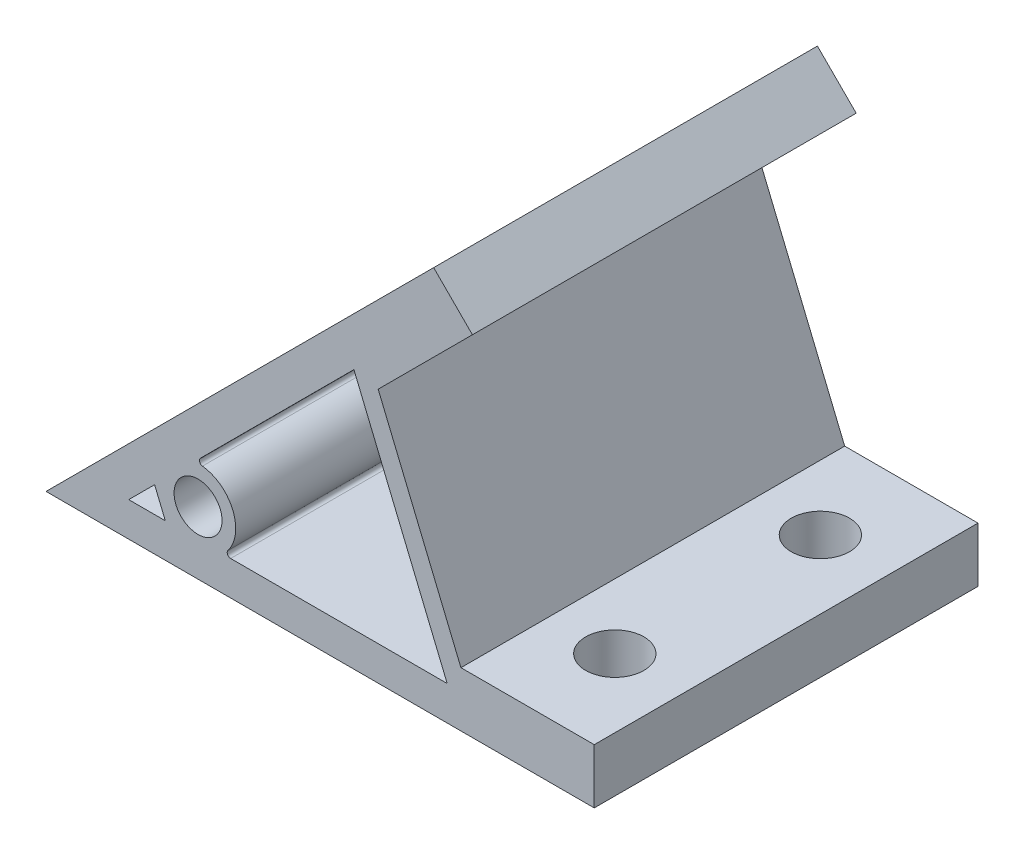
from build123d import *

# Parameters (mm, degrees)
SKETCH_1_R          = 3.5
EXTRUDE_1_DEPTH     = 28
SKETCH_3_R          = 4.25
CUT_EXTRUDE_2_DEPTH = 20


with BuildPart() as part:
    # 草图1 → 凸台-拉伸1 (new, symmetric)
    with BuildSketch(Plane.XY):
        Polygon((0, 0), (56.568542495, 56.568542495), (62.225396744, 50.911688245), (48.470353518, 37.156645019), (60.547431318, 8), (80, 8), (80, 0), align=None)
        with Locations((22.184677187, 9.156473773)):
            Circle(SKETCH_1_R, mode=Mode.SUBTRACT)
        Polygon((12.071067812, 5), (15.847671377, 8.776603565), (17.411991793, 5), align=None, mode=Mode.SUBTRACT)
        with BuildLine():
            Line((22.539170943, 15.468103131), (44.931612237, 37.860544425))
            Line((44.931612237, 37.860544425), (58.542895405, 5))
            Line((58.542895405, 5), (26.941798117, 5))
            ThreePointArc((26.941798117, 5), (26.493271042, 5.27903968), (26.545371373, 5.804706148))
            ThreePointArc((26.545371373, 5.804706148), (27.253512915, 11.291164467), (22.833720405, 14.61804341))
            ThreePointArc((22.833720405, 14.61804341), (22.420282519, 14.950846558), (22.539170943, 15.468103131))
        make_face(mode=Mode.SUBTRACT)
    extrude(amount=EXTRUDE_1_DEPTH, both=True)

    # 草图3 → 切除-拉伸2 (cut)
    with BuildSketch(Plane.XZ):
        with Locations(Location((70, 15, 0), (0, 0, 270))):
            Circle(SKETCH_3_R)
        with Locations(Location((70, -15, 0), (0, 0, 270))):
            Circle(SKETCH_3_R)
    cut_extrude_2 = extrude(amount=-CUT_EXTRUDE_2_DEPTH, mode=Mode.SUBTRACT)

    # 镜向1: 切除-拉伸2 across plane
    add(cut_extrude_2.mirror(Plane(origin=(0, 0, 0), x_dir=(0, 0, 1), z_dir=(0.3826834323650904, -0.9238795325112865, 0))), mode=Mode.SUBTRACT)


solid = part.part
